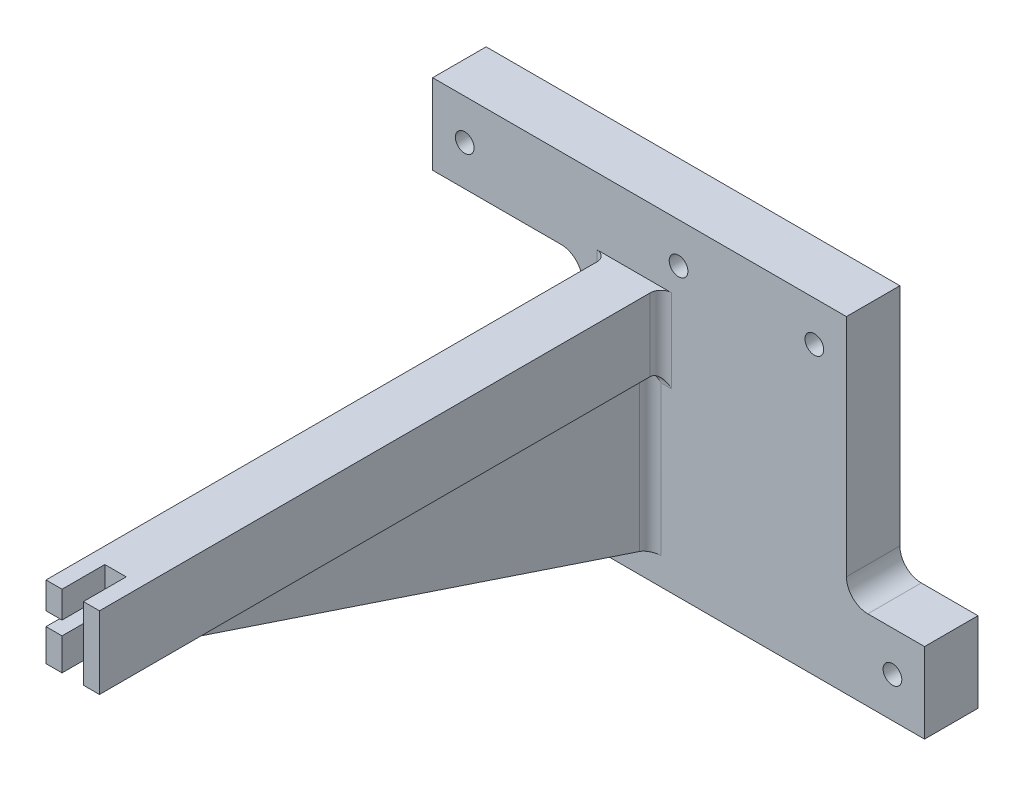
from build123d import *

# Parameters (mm, degrees)
SKETCH1_R           = 1.75
BOSS_EXTRUDE1_DEPTH = 10
BOSS_EXTRUDE2_DEPTH = 105
RIB1_REACH          = 140.024
SKETCH3_WALL_W      = 372.917163166
SKETCH3_WALL_H      = 6
FILLET1_R           = 2
FILLET2_R           = 4
SKETCH4_W           = 4
SKETCH4_H           = 13.56
CUT_EXTRUDE1_DEPTH  = 8


with BuildPart() as part:
    # Sketch1 → Boss-Extrude1 (new body)
    with BuildSketch(Plane.XY):
        Polygon((-45.99, 7.5), (-45.99, -7.5), (-17.99, -7.5), (-17.99, -53.64), (46, -53.64), (46, -38.64), (31.39, -38.64), (31.39, 7.5), align=None)
        Circle(SKETCH1_R, mode=Mode.SUBTRACT)
        with Locations((25.39, 0)):
            Circle(SKETCH1_R, mode=Mode.SUBTRACT)
        with Locations((-39.99, 0)):
            Circle(SKETCH1_R, mode=Mode.SUBTRACT)
        with Locations((40, -46.14)):
            Circle(SKETCH1_R, mode=Mode.SUBTRACT)
    extrude(amount=BOSS_EXTRUDE1_DEPTH)

    # Sketch2 → Boss-Extrude2 (add)
    with BuildSketch(Plane.XY.offset(10)):
        Polygon((-13.3, -5), (-3.3, -5), (-3.3, -18.56), (-13.3, -18.56), (-13.3, -12.56), (-8.3, -12.56), (-8.3, -10), (-13.3, -10), align=None)
    extrude(amount=BOSS_EXTRUDE2_DEPTH)

    # Sketch3 wall → Rib1 (add, up to next)
    with BuildSketch(Plane(origin=(-8.3, -33.56, 55), x_dir=(0, 0.316227766017, 0.948683298051), z_dir=(0, -0.948683298051, 0.316227766017)), mode=Mode.PRIVATE) as rib1_sk1:
        Rectangle(SKETCH3_WALL_W, SKETCH3_WALL_H)
    rib1_tool1 = extrude(rib1_sk1.sketch, amount=-RIB1_REACH, mode=Mode.PRIVATE) - part.part
    add(rib1_tool1.solids().sort_by_distance((-8.3, -33.56, 55))[0])

    # Fillet1
    fillet1_edges = [part.edges().sort_by_distance(p)[0] for p in [
        (-13.3, -7.5, 10),
        (-13.3, -15.56, 10),
        (-12.3, -18.56, 10),
        (-11.3, -33.56, 10),
        (-3.3, -11.78, 10),
        (-4.3, -18.56, 10),
        (-5.3, -33.56, 10),
    ]]
    fillet(fillet1_edges, radius=FILLET1_R)

    # Fillet2
    fillet2_edges = [part.edges().sort_by_distance(p)[0] for p in [
        (31.39, -38.64, 5),
        (-17.99, -53.64, 5),
        (-17.99, -7.5, 5),
    ]]
    fillet(fillet2_edges, radius=FILLET2_R)

    # Sketch4 → Cut-Extrude1 (cut)
    with BuildSketch(Plane.XY.offset(115)):
        with Locations((-8.3, -11.78)):
            Rectangle(SKETCH4_W, SKETCH4_H)
    extrude(amount=-CUT_EXTRUDE1_DEPTH, mode=Mode.SUBTRACT)


solid = part.part
